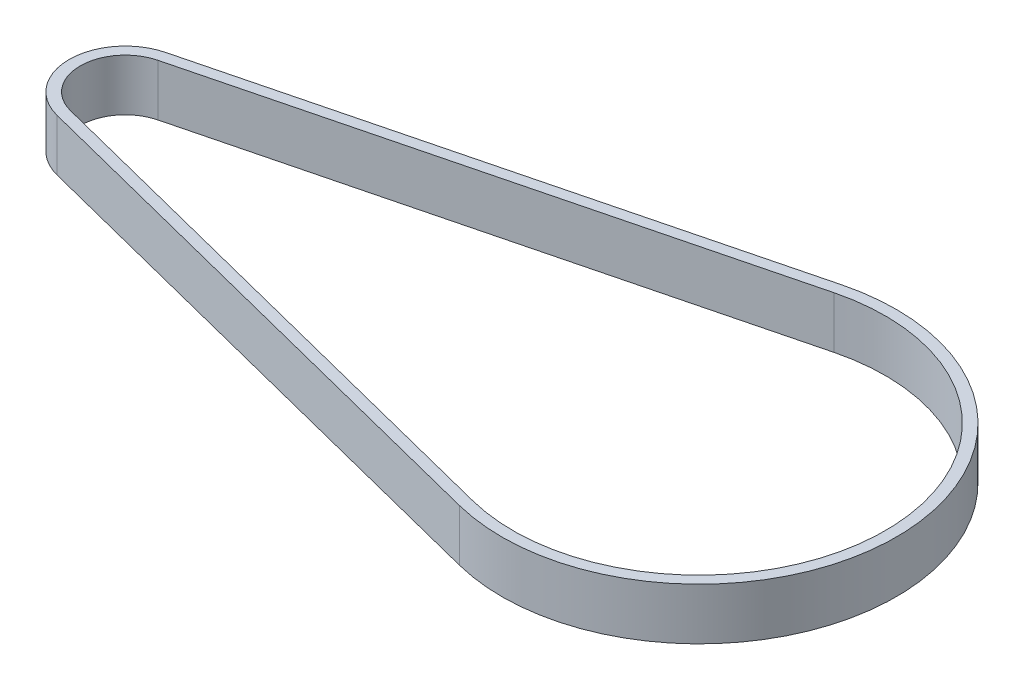
from build123d import *

# Parameters (mm, degrees)
BOSS_EXTRUDE1_DEPTH = 7


with BuildPart() as part:
    # Sketch1 → Boss-Extrude1 (new body)
    with BuildSketch(Plane(origin=(0, 0, 0), x_dir=(1, 0, 0), z_dir=(0, 1, 0))):
        with BuildLine():
            Line((-1.868211068, 7.366803065), (71.136679537, 25.880742348))
            ThreePointArc((71.136679537, 25.880742348), (104.4, 0), (71.136679537, -25.880742348))
            Line((71.136679537, -25.880742348), (-1.868211068, -7.366803065))
            ThreePointArc((-1.868211068, -7.366803065), (-7.6, 0), (-1.868211068, 7.366803065))
        make_face()
        with BuildLine():
            Line((-1.499485199, 5.912828776), (71.505405405, 24.426768059))
            ThreePointArc((71.505405405, 24.426768059), (102.9, 0), (71.505405405, -24.426768059))
            Line((71.505405405, -24.426768059), (-1.499485199, -5.912828776))
            ThreePointArc((-1.499485199, -5.912828776), (-6.1, 0), (-1.499485199, 5.912828776))
        make_face(mode=Mode.SUBTRACT)
    extrude(amount=BOSS_EXTRUDE1_DEPTH)


solid = part.part
